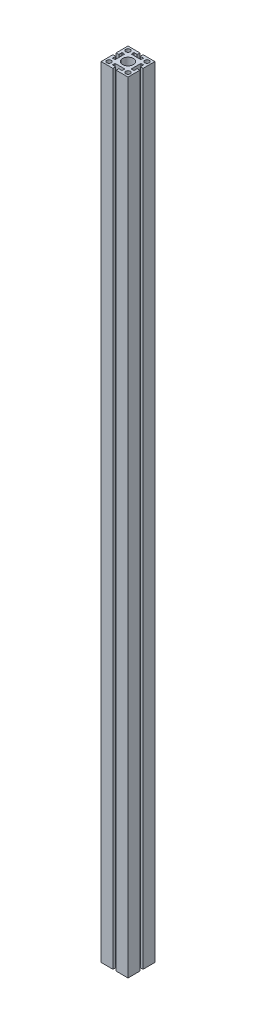
from build123d import *

# Parameters (mm, degrees)
SKETCH1_R           = 10
SKETCH1_R_2         = 4.138691164
BOSS_EXTRUDE1_DEPTH = 1450


with BuildPart() as part:
    # Sketch1 → Boss-Extrude1 (new body)
    with BuildSketch(Plane(origin=(0, 0, 0), x_dir=(1, 0, 0), z_dir=(0, 1, 0))):
        Polygon((-25, -3), (-25, -25), (-3, -25), (-3, -20), (-9, -20), (-9, -15), (9, -15), (9, -20), (3, -20), (3, -25), (25, -25), (25, -3), (20, -3), (20, -9), (15, -9), (15, 9), (20, 9), (20, 3), (25, 3), (25, 25), (3, 25), (3, 20), (9, 20), (9, 15), (-9, 15), (-9, 20), (-3, 20), (-3, 25), (-25, 25), (-25, 3), (-20, 3), (-20, 9), (-15, 9), (-15, -9), (-20, -9), (-20, -3), align=None)
        with Locations(Location((0, 0, 0), (0, 0, 270))):
            Circle(SKETCH1_R, mode=Mode.SUBTRACT)
        with Locations(Location((-17.67766953, 17.67766953, 0), (0, 0, 270))):
            Circle(SKETCH1_R_2, mode=Mode.SUBTRACT)
        with Locations(Location((17.67766953, 17.67766953, 0), (0, 0, 270))):
            Circle(SKETCH1_R_2, mode=Mode.SUBTRACT)
        with Locations(Location((17.67766953, -17.67766953, 0), (0, 0, 270))):
            Circle(SKETCH1_R_2, mode=Mode.SUBTRACT)
        with Locations(Location((-17.67766953, -17.67766953, 0), (0, 0, 270))):
            Circle(SKETCH1_R_2, mode=Mode.SUBTRACT)
    extrude(amount=BOSS_EXTRUDE1_DEPTH)


solid = part.part
